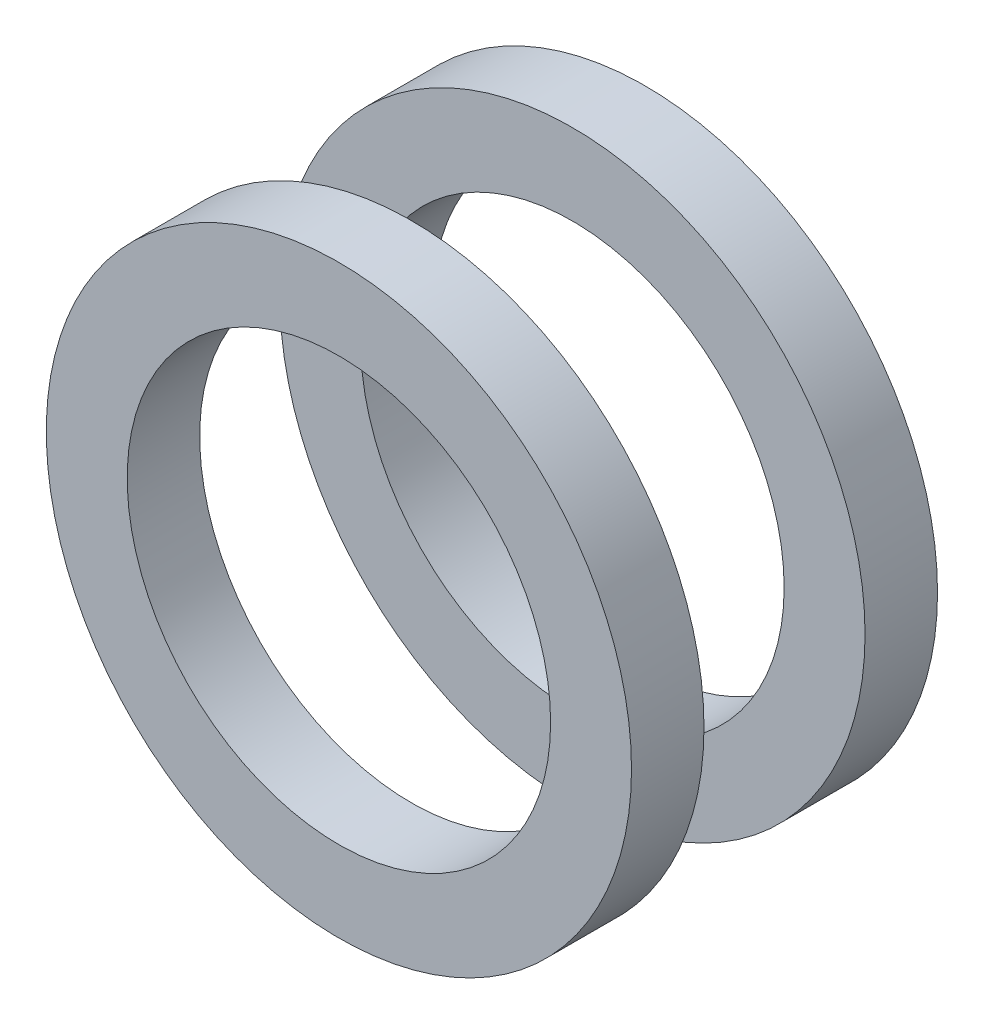
from build123d import *

# Parameters (mm, degrees)
ENDTURN_R_START = 20
SKETCH_1_R      = 72.669230769
SKETCH_1_R_2    = 52.576923077
ENDTURN_R_DEPTH = 18
ENDTURN_L_START = -38
SKETCH_2_R      = 72.669230769
SKETCH_2_R_2    = 52.576923077
ENDTURN_L_DEPTH = 18


with BuildPart() as part:
    # Эскиз1 → Endturn_R (new body)
    with BuildSketch(Plane.XY.offset(ENDTURN_R_START)):
        Circle(SKETCH_1_R)
        Circle(SKETCH_1_R_2, mode=Mode.SUBTRACT)
    extrude(amount=ENDTURN_R_DEPTH)


with BuildPart() as body_2:
    # Эскиз2 → Endturn_L (new body)
    with BuildSketch(Plane.XY.offset(ENDTURN_L_START)):
        Circle(SKETCH_2_R)
        Circle(SKETCH_2_R_2, mode=Mode.SUBTRACT)
    extrude(amount=ENDTURN_L_DEPTH)


solid = Compound([part.part, body_2.part])
